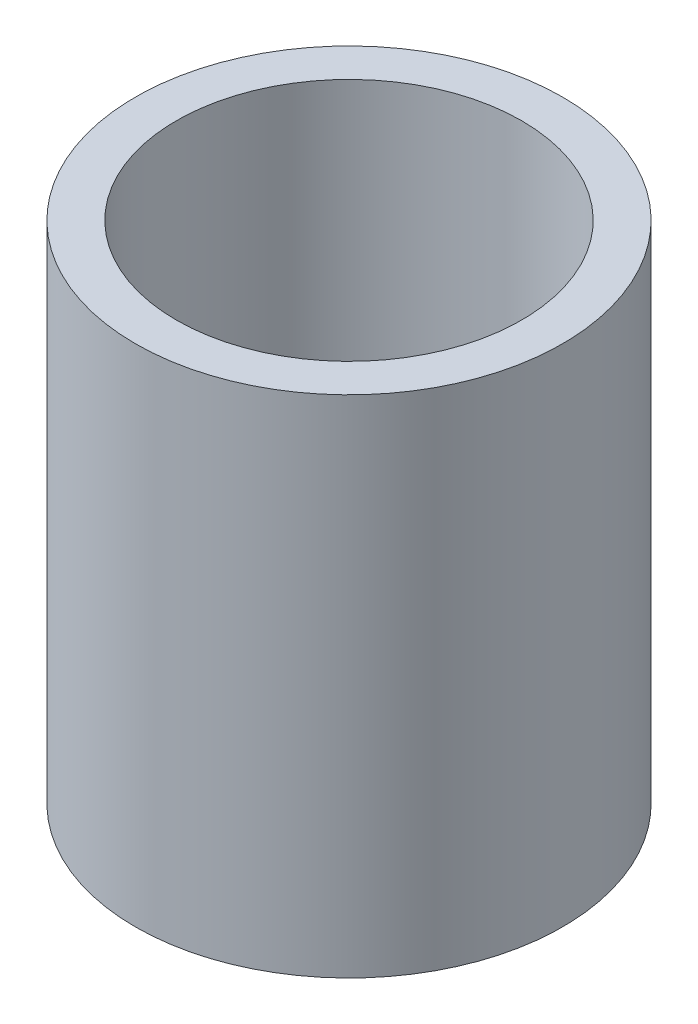
from build123d import *

# Parameters (mm, degrees)
SKETCH1_R           = 7.825
SKETCH1_R_2         = 6.325
BOSS_EXTRUDE1_DEPTH = 12.75
BOSS_EXTRUDE2_START = -5.75
SKETCH1_2_R         = 7.825
BOSS_EXTRUDE2_DEPTH = 5.75
CUT_EXTRUDE1_DEPTH  = 5.75


with BuildPart() as part:
    # Sketch1 → Boss-Extrude1 (new body)
    with BuildSketch(Plane(origin=(0, 0, 0), x_dir=(1, 0, 0), z_dir=(0, 1, 0))):
        Circle(SKETCH1_R)
        Circle(SKETCH1_R_2, mode=Mode.SUBTRACT)
    extrude(amount=BOSS_EXTRUDE1_DEPTH)

    # Sketch1<2> → Boss-Extrude2 (add)
    with BuildSketch(Plane(origin=(0, 0, 0), x_dir=(1, 0, 0), z_dir=(0, 1, 0)).offset(BOSS_EXTRUDE2_START)):
        Circle(SKETCH1_2_R)
    extrude(amount=BOSS_EXTRUDE2_DEPTH)

    # Sketch2 → Cut-Extrude1 (cut)
    with BuildSketch(Plane.XZ.offset(5.75)):
        with BuildLine():
            Line((-2, 1.525), (2, 1.525))
            ThreePointArc((2, 1.525), (3.525, 0), (2, -1.525))
            Line((2, -1.525), (-2, -1.525))
            ThreePointArc((-2, -1.525), (-3.525, 0), (-2, 1.525))
        make_face()
    extrude(amount=-CUT_EXTRUDE1_DEPTH, mode=Mode.SUBTRACT)


solid = part.part
